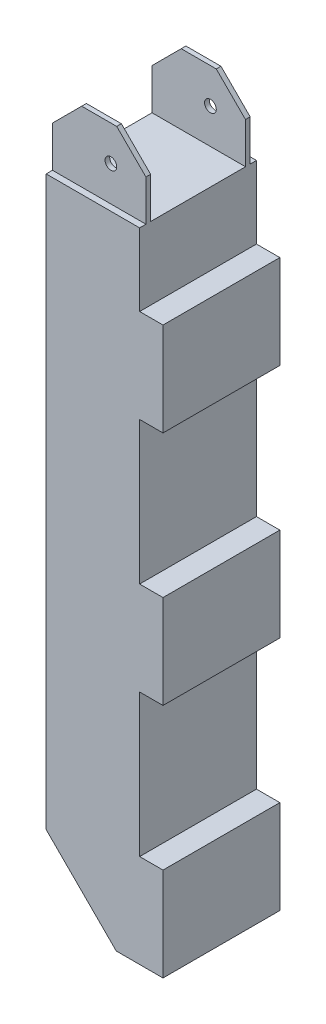
from build123d import *

# Parameters (mm, degrees)
BOSS_EXTRUDE1_DEPTH     = 5
SKETCH4_W               = 5
SKETCH4_H               = 6.1
CUT_EXTRUDE1_DEPTH      = 1
CHAMFER1_SIZE           = 3
CUT_EXTRUDE8_DEPTH      = 104.701494685
CUT_EXTRUDE8_DEPTH_BACK = 104.701494685
SKETCH13_R              = 0.25
CUT_EXTRUDE9_DEPTH      = 101.249688279
SKETCH14_W              = 0.27
SKETCH14_H              = 3
CUT_EXTRUDE11_DEPTH     = 101.204790305
SKETCH16_W              = 4.06
SKETCH16_H              = 3
CUT_EXTRUDE12_DEPTH     = 101.204790305
CHAMFER4_SIZE           = 1.25
CHAMFER7_SIZE           = 1.25
CHAMFER8_SIZE           = 1.25
CHAMFER9_SIZE           = 1.25


with BuildPart() as part:
    # Sketch1 → Boss-Extrude1 (new body)
    with BuildSketch(Plane.XY):
        with BuildLine():
            Line((0, -100), (-5, -100))
            Line((-5, -100), (-5, -60))
            Line((-5, -60), (-12, -5))
            Line((-12, -5), (-27, -5))
            Line((-27, -5), (-27, 0))
            Line((-27, 0), (-3, 0))
            Line((-3, 0), (-3, -37.2))
            ThreePointArc((-3, -37.2), (-2.179898987, -39.179898987), (-0.2, -40))
            Line((-0.2, -40), (0, -40))
            Line((0, -40), (0, -100))
        make_face()
    extrude(amount=BOSS_EXTRUDE1_DEPTH)

    # Sketch4 → Cut-Extrude1 (cut)
    with BuildSketch(Plane(origin=(0, 0, 0), x_dir=(0, 0, -1), z_dir=(1, 0, 0))):
        with Locations((-2.5, -92.95)):
            Rectangle(SKETCH4_W, SKETCH4_H)
        with Locations((-2.5, -82.85)):
            Rectangle(SKETCH4_W, SKETCH4_H)
        with Locations((-2.5, -72.75)):
            Rectangle(SKETCH4_W, SKETCH4_H)
        with Locations((-2.5, -62.65)):
            Rectangle(SKETCH4_W, SKETCH4_H)
        with Locations((-2.5, -52.55)):
            Rectangle(SKETCH4_W, SKETCH4_H)
        with Locations((-2.5, -42.45)):
            Rectangle(SKETCH4_W, SKETCH4_H)
    extrude(amount=-CUT_EXTRUDE1_DEPTH, mode=Mode.SUBTRACT)

    # Chamfer1
    chamfer1_edges = [part.edges().sort_by_distance(p)[0] for p in [
        (-5, -100, 2.5),
    ]]
    chamfer(chamfer1_edges, length=CHAMFER1_SIZE)

    # Sketch9 → Cut-Extrude8 (cut, two sides: drawn at the far end of the back side and taken through both)
    with BuildSketch(Plane.XY.offset(5).offset(-CUT_EXTRUDE8_DEPTH_BACK)):
        Polygon((157.782929128, -69.7), (-1, -69.7), (-5, -69.7), (-163.782929128, -69.7), (-163.782929128, 247.865858257), (157.782929128, 247.865858257), align=None)
    extrude(amount=CUT_EXTRUDE8_DEPTH + CUT_EXTRUDE8_DEPTH_BACK, mode=Mode.SUBTRACT)

    # Sketch13 → Cut-Extrude9 (cut, through all)
    with BuildSketch(Plane.XY.offset(5)):
        with Locations((-2.5, -71.2)):
            Circle(SKETCH13_R)
    extrude(amount=-CUT_EXTRUDE9_DEPTH, mode=Mode.SUBTRACT)

    # Sketch14 → Cut-Extrude11 (cut, through all)
    with BuildSketch(Plane(origin=(-1, 0, 0), x_dir=(0, 0, -1), z_dir=(1, 0, 0))):
        with Locations((-4.865, -71.2)):
            Rectangle(SKETCH14_W, SKETCH14_H)
        with Locations((-0.135, -71.2)):
            Rectangle(SKETCH14_W, SKETCH14_H)
    extrude(amount=-CUT_EXTRUDE11_DEPTH, mode=Mode.SUBTRACT)

    # Sketch16 → Cut-Extrude12 (cut, through all)
    with BuildSketch(Plane(origin=(-1, 0, 0), x_dir=(0, 0, -1), z_dir=(1, 0, 0))):
        with Locations((-2.5, -71.2)):
            Rectangle(SKETCH16_W, SKETCH16_H)
    extrude(amount=-CUT_EXTRUDE12_DEPTH, mode=Mode.SUBTRACT)

    # Chamfer4
    chamfer4_edges = [part.edges().sort_by_distance(p)[0] for p in [
        (-1, -69.7, 4.63),
    ]]
    chamfer(chamfer4_edges, length=CHAMFER4_SIZE)

    # Chamfer7
    chamfer7_edges = [part.edges().sort_by_distance(p)[0] for p in [
        (-1, -69.7, 0.37),
    ]]
    chamfer(chamfer7_edges, length=CHAMFER7_SIZE)

    # Chamfer8
    chamfer8_edges = [part.edges().sort_by_distance(p)[0] for p in [
        (-5, -69.7, 4.63),
    ]]
    chamfer(chamfer8_edges, length=CHAMFER8_SIZE)

    # Chamfer9
    chamfer9_edges = [part.edges().sort_by_distance(p)[0] for p in [
        (-5, -69.7, 0.37),
    ]]
    chamfer(chamfer9_edges, length=CHAMFER9_SIZE)


solid = part.part
